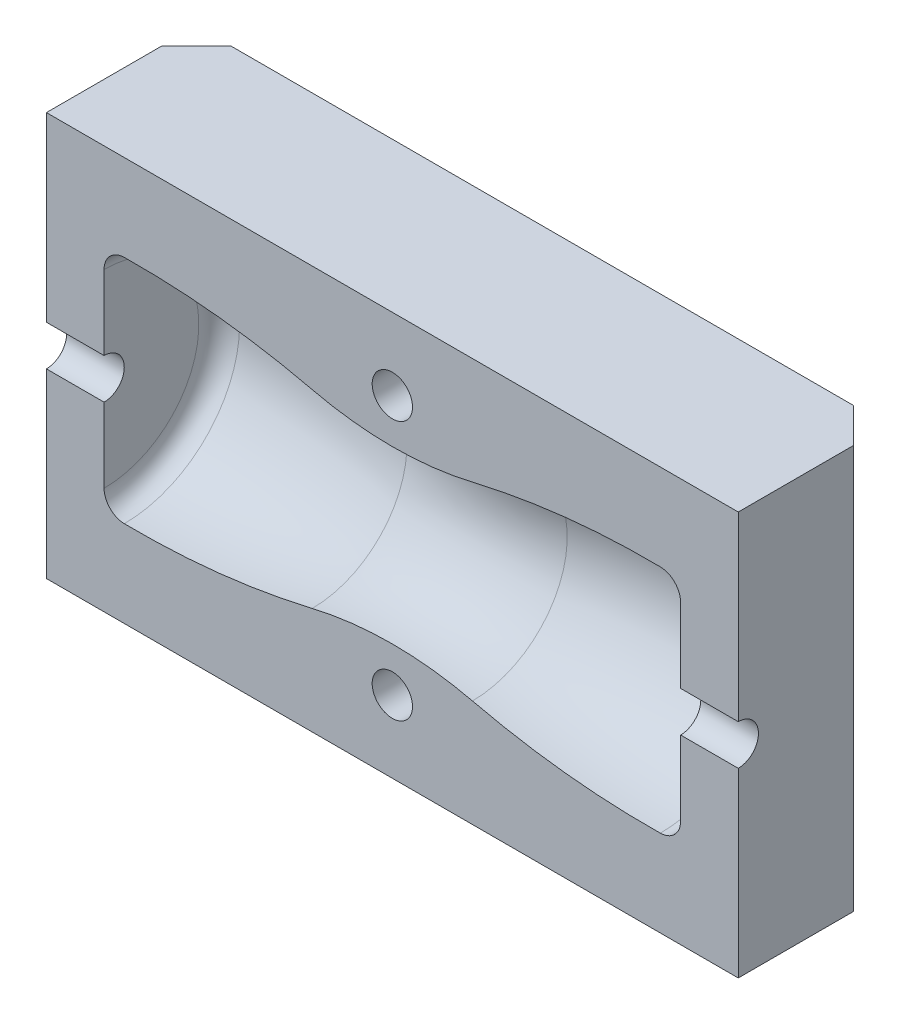
from build123d import *

# Parameters (mm, degrees)
SKETCH1_W               = 60
SKETCH1_H               = 35
BOSS_EXTRUDE1_DEPTH     = 13
CUT_EXTRUDE1_DEPTH      = 64.837684937
CUT_EXTRUDE1_DEPTH_BACK = 64.837684937
SKETCH3_R               = 1.75
SKETCH5_R               = 1.75
CUT_EXTRUDE3_DEPTH      = 38.08436341
CHAMFER1_SIZE           = 3
CUT_EXTRUDE4_DEPTH      = 7
CHAMFER2_SIZE           = 0.5


with BuildPart() as part:
    # Sketch1 → Boss-Extrude1 (new body)
    with BuildSketch(Plane.XY):
        Rectangle(SKETCH1_W, SKETCH1_H)
    extrude(amount=BOSS_EXTRUDE1_DEPTH)

    # Sketch2 → Cut-Revolve1 (revolve, cut)
    with BuildSketch(Plane.XY.offset(13)):
        with BuildLine():
            Line((-25, 0), (-25, 8.218127455))
            ThreePointArc((-25, 8.218127455), (-24.486963528, 9.469250598), (-23.243251097, 10))
            ThreePointArc((-23.243251097, 10), (-15.040879193, 9.611248064), (-6.94833646, 8.218127455))
            ThreePointArc((-6.94833646, 8.218127455), (0, 7.408356031), (6.94833646, 8.218127455))
            ThreePointArc((6.94833646, 8.218127455), (15.040879193, 9.611248064), (23.243251097, 10))
            ThreePointArc((23.243251097, 10), (24.486963528, 9.469250598), (25, 8.218127455))
            Line((25, 8.218127455), (25, 0))
            Line((25, 0), (-25, 0))
        make_face()
    revolve(axis=Axis((25, 0, 13), (-1, 0, 0)), mode=Mode.SUBTRACT)

    # Sketch3 → Cut-Extrude1 (cut, two sides: drawn at the far end of the back side and taken through both)
    with BuildSketch(Plane(origin=(30, 0, 0), x_dir=(0, 0, -1), z_dir=(1, 0, 0)).offset(-CUT_EXTRUDE1_DEPTH_BACK)):
        with Locations((-13, 0)):
            Circle(SKETCH3_R)
    extrude(amount=CUT_EXTRUDE1_DEPTH + CUT_EXTRUDE1_DEPTH_BACK, mode=Mode.SUBTRACT)

    # Sketch5 → Cut-Extrude3 (cut, through all)
    with BuildSketch(Plane.XY.offset(13)):
        with Locations((0, 11.25)):
            Circle(SKETCH5_R)
        with Locations((0, -11.25)):
            Circle(SKETCH5_R)
    extrude(amount=-CUT_EXTRUDE3_DEPTH, mode=Mode.SUBTRACT)

    # Chamfer1
    chamfer1_edges = [part.edges().sort_by_distance(p)[0] for p in [
        (-30, 0, 0),
        (30, 0, 0),
    ]]
    chamfer(chamfer1_edges, length=CHAMFER1_SIZE)

    # Sketch6 → Cut-Extrude4 (cut)
    with BuildSketch(Plane(origin=(0, 0, 0), x_dir=(-1, 0, 0), z_dir=(0, 0, -1))):
        Polygon((3.464101615, 11.25), (1.732050808, 14.25), (-1.732050808, 14.25), (-3.464101615, 11.25), (-1.732050808, 8.25), (1.732050808, 8.25), align=None)
        Polygon((3.464101615, -11.25), (1.732050808, -8.25), (-1.732050808, -8.25), (-3.464101615, -11.25), (-1.732050808, -14.25), (1.732050808, -14.25), align=None)
    extrude(amount=-CUT_EXTRUDE4_DEPTH, mode=Mode.SUBTRACT)

    # Chamfer2
    chamfer2_edges = [part.edges().sort_by_distance(p)[0] for p in [
        (-2.598076211, 9.75, 0),
        (-2.598076211, 12.75, 0),
        (0, 14.25, 0),
        (2.598076211, 12.75, 0),
        (2.598076211, 9.75, 0),
        (0, 8.25, 0),
        (-2.598076211, 9.75, 7),
        (0, 8.25, 7),
        (2.598076211, 9.75, 7),
        (2.598076211, 12.75, 7),
        (0, 14.25, 7),
        (-2.598076211, 12.75, 7),
        (-1.75, 11.25, 7),
        (-2.598076211, -12.75, 0),
        (-2.598076211, -9.75, 0),
        (0, -8.25, 0),
        (2.598076211, -9.75, 0),
        (2.598076211, -12.75, 0),
        (0, -14.25, 0),
        (-2.598076211, -12.75, 7),
        (0, -14.25, 7),
        (2.598076211, -12.75, 7),
        (2.598076211, -9.75, 7),
        (0, -8.25, 7),
        (-2.598076211, -9.75, 7),
        (-1.75, -11.25, 7),
    ]]
    chamfer(chamfer2_edges, length=CHAMFER2_SIZE)


solid = part.part
